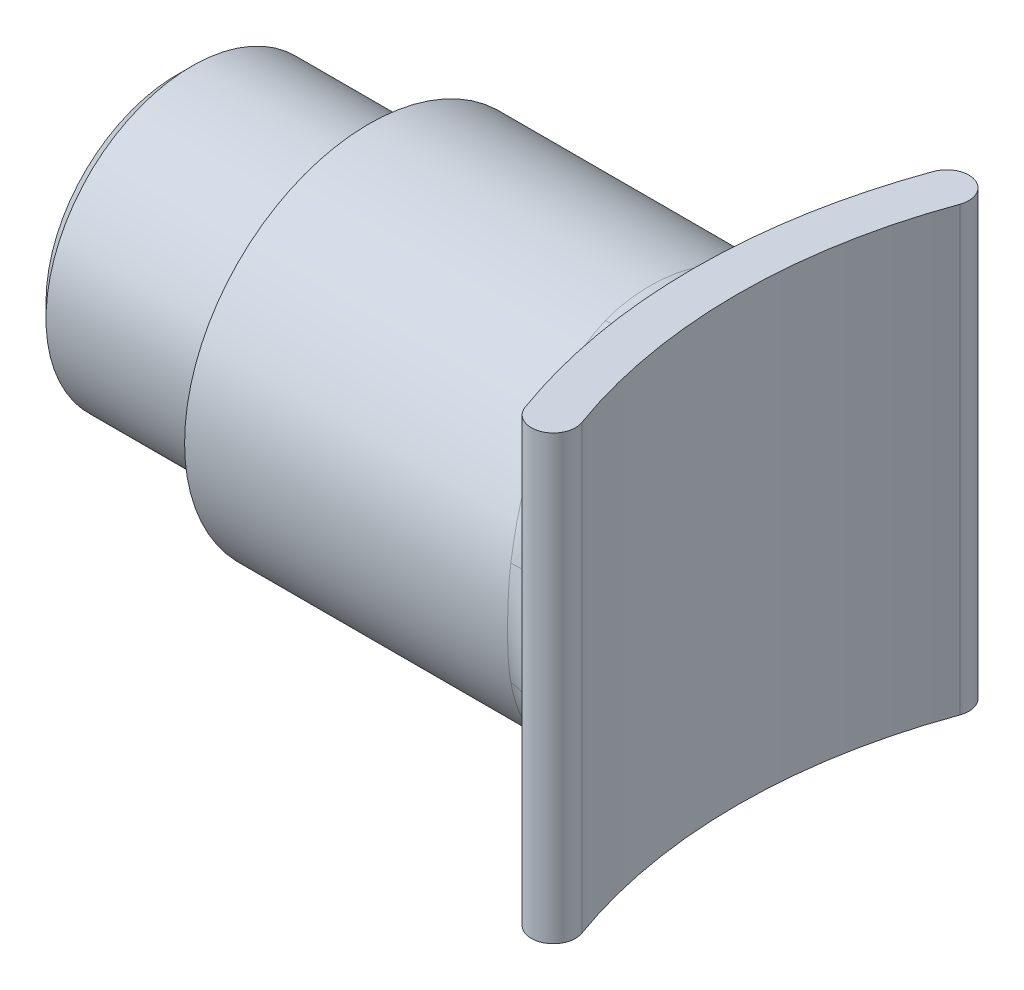
from build123d import *
from build123d.topology import SkipClean

# Parameters (mm, degrees)
BOSS_EXTRUDE1_DEPTH                  = 15
SKETCH2_R                            = 12.5
BOSS_EXTRUDE2_DEPTH                  = 22
BOSS_EXTRUDE2_DIRECTION_2_REACH      = 23.768
BOSS_EXTRUDE2_DIRECTION_2_END_RADIUS = 40.5
SKETCH3_R                            = 9.9
BOSS_EXTRUDE3_DEPTH                  = 13
CHAMFER1_SIZE                        = 1
FILLET7_R                            = 3


with BuildPart() as part:
    # Sketch1 → Boss-Extrude1 (new, symmetric)
    with BuildSketch(Plane(origin=(0, 0, 0), x_dir=(1, 0, 0), z_dir=(0, 1, 0))):
        with BuildLine():
            ThreePointArc((2.261526721, 12.825755375), (0, 0), (2.261526721, -12.825755375))
            ThreePointArc((2.261526721, -12.825755375), (1.365018004, -14.748324521), (-0.557551142, -13.851815805))
            ThreePointArc((-0.557551142, -13.851815805), (-3, 0), (-0.557551142, 13.851815805))
            ThreePointArc((-0.557551142, 13.851815805), (1.365018004, 14.748324521), (2.261526721, 12.825755375))
        make_face()
    extrude(amount=BOSS_EXTRUDE1_DEPTH, both=True)

    # Sketch2 → Boss-Extrude2 (add)
    with BuildSketch(Plane.ZY.offset(3)):
        with Locations(Location((0, 0, 0), (0, 0, 180))):
            Circle(SKETCH2_R)
    extrude(amount=BOSS_EXTRUDE2_DEPTH)

    # Boss-Extrude2 direction 2: up to this cylinder (the profile starts outside it)
    with SkipClean():  # the faces are left unmerged after this step: merging them gives an invalid solid
        boss_extrude2_direction_2_end = Plane(origin=(37.5, 0, 0), z_dir=(0, -1, 0)) * Cylinder(BOSS_EXTRUDE2_DIRECTION_2_END_RADIUS, 129.536, mode=Mode.PRIVATE)
        # Sketch2 → Boss-Extrude2 direction 2 (add, up to the surface)
        with BuildSketch(Plane.ZY.offset(3), mode=Mode.PRIVATE) as boss_extrude2_direction_2_sk1:
            with Locations(Location((0, 0, 0), (0, 0, 180))):
                Circle(SKETCH2_R)
        boss_extrude2_direction_2_tool1 = extrude(boss_extrude2_direction_2_sk1.sketch, amount=-BOSS_EXTRUDE2_DIRECTION_2_REACH, mode=Mode.PRIVATE) - boss_extrude2_direction_2_end
        add(boss_extrude2_direction_2_tool1.solids().sort_by_distance((-3, 0, 0))[0])
        add(boss_extrude2_direction_2_tool1.solids().sort_by_distance((-3, 0, 0))[1])

    # Sketch3 → Boss-Extrude3 (add)
    with BuildSketch(Plane.ZY.offset(25)):
        with Locations(Location((0, 0, 0), (0, 0, 180))):
            Circle(SKETCH3_R)
    extrude(amount=BOSS_EXTRUDE3_DEPTH)

    # Chamfer1
    chamfer1_edges = [part.edges().sort_by_distance(p)[0] for p in [
        (-38, 0, 9.9),
    ]]
    chamfer(chamfer1_edges, length=CHAMFER1_SIZE)

    # Fillet7
    fillet7_edges = [part.edges().sort_by_distance(p)[0] for p in [
        (-1.022720569, 0, 12.5),
    ]]
    fillet(fillet7_edges, radius=FILLET7_R)


solid = part.part
